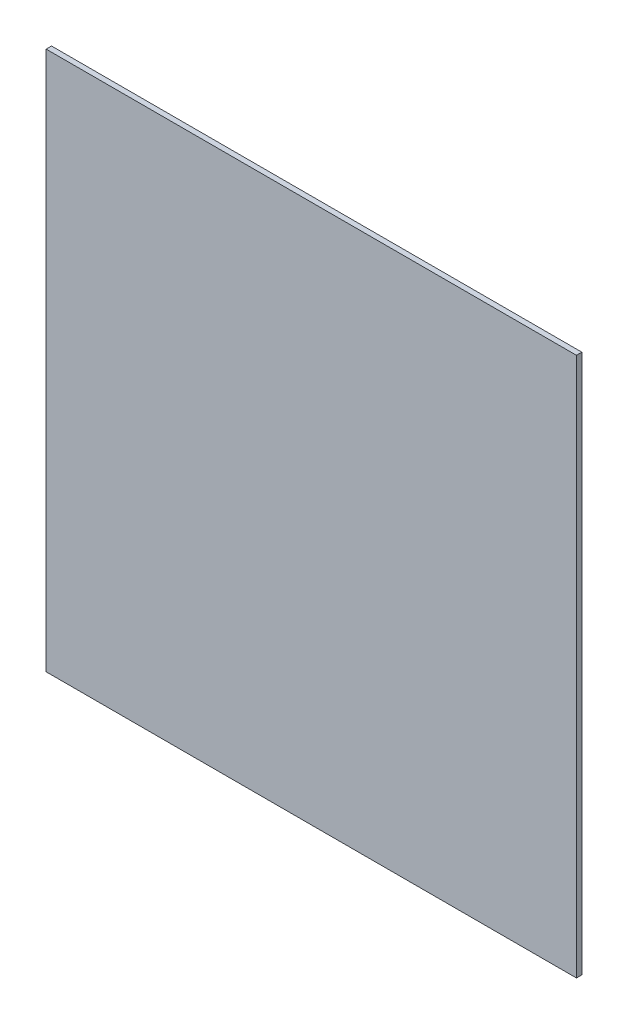
from build123d import *

# Parameters (mm, degrees)
SKETCH_1_W      = 590
SKETCH_1_H      = 600
EXTRUDE_1_DEPTH = 6


with BuildPart() as part:
    # Эскиз1 → Бобышка-Вытянуть1 (new body)
    with BuildSketch(Plane.XY):
        with Locations((295, 300)):
            Rectangle(SKETCH_1_W, SKETCH_1_H)
    extrude(amount=EXTRUDE_1_DEPTH)


solid = part.part
